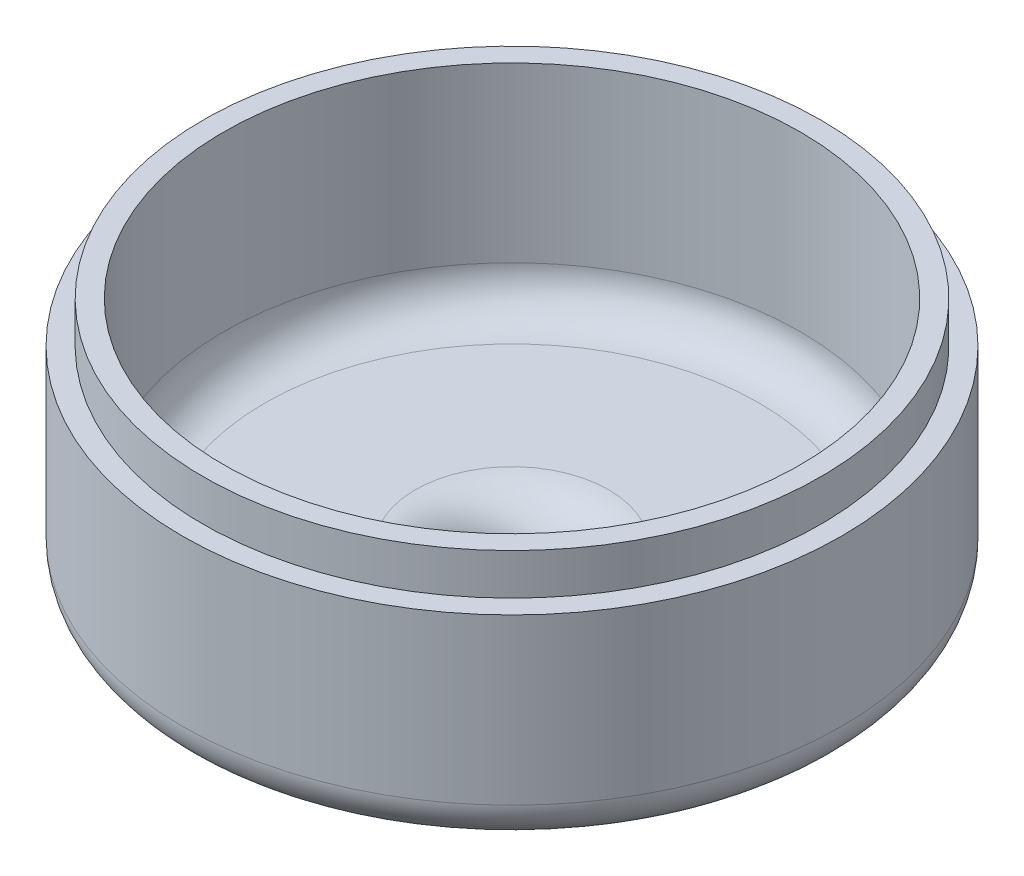
from build123d import *


with BuildPart() as part:
    # Sketch1 → Revolve1 (revolve)
    with BuildSketch(Plane.XY, mode=Mode.PRIVATE) as revolve1_sk:
        with BuildLine():
            Line((-40, 5), (-40, -15))
            ThreePointArc((-40, -15), (-38.535533906, -18.535533906), (-35, -20))
            Line((-35, -20), (-16, -20))
            ThreePointArc((-16, -20), (-11.757359313, -21.757359313), (-10, -26))
            Line((-10, -26), (-10, -28.486287513))
            Line((-10, -28.486287513), (-5.75, -28.486287513))
            Line((-5.75, -28.486287513), (-5.75, -22))
            ThreePointArc((-5.75, -22), (-7.507359313, -17.757359313), (-11.75, -16))
            Line((-11.75, -16), (-30, -16))
            ThreePointArc((-30, -16), (-33.535533906, -14.535533906), (-35, -11))
            Line((-35, -11), (-35, 10))
            Line((-35, 10), (-37.5, 10))
            Line((-37.5, 10), (-37.5, 5))
            Line((-37.5, 5), (-40, 5))
        make_face()
    revolve(revolve1_sk.sketch.rotate(Axis((0, 0, 0), (0, 1, 0)), 270), axis=Axis((0, 0, 0), (0, 1, 0)))


solid = part.part
